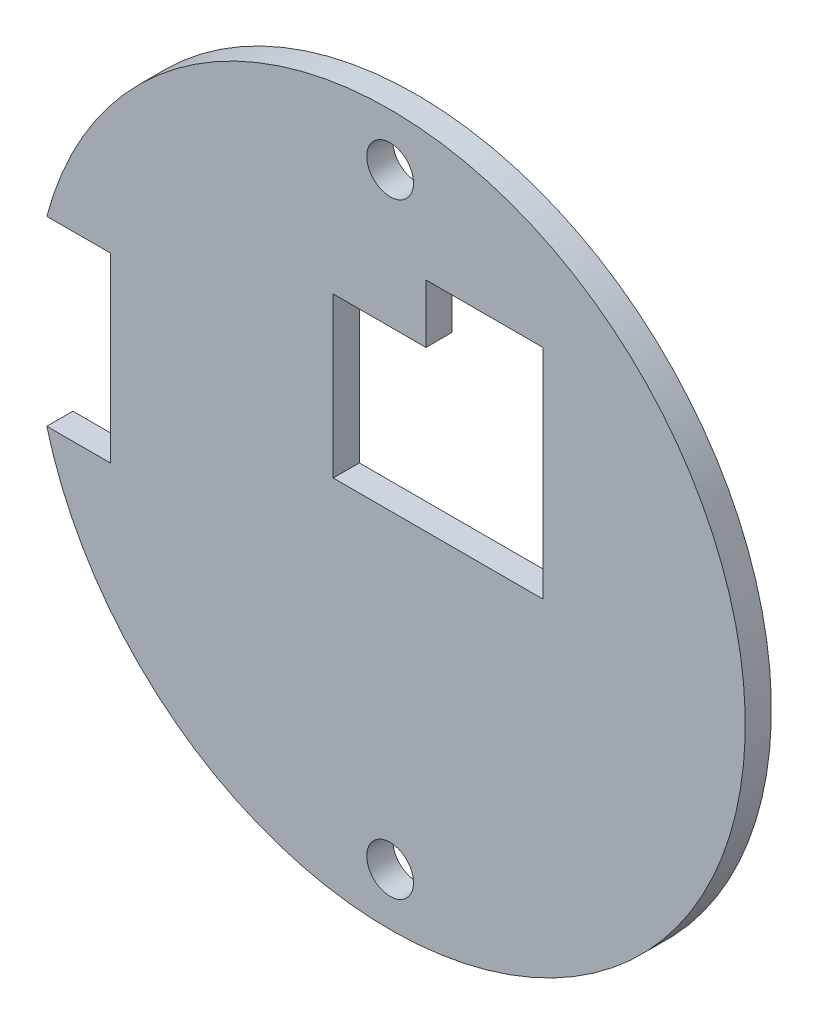
from build123d import *

# Parameters (mm, degrees)
SKETCH1_R           = 1.4224
BOSS_EXTRUDE1_DEPTH = 1.5875


with BuildPart() as part:
    # Sketch1 → Boss-Extrude1 (new body)
    with BuildSketch(Plane.XY):
        with BuildLine():
            Line((-16.984058744, 5.5245), (-20.871224203, 5.5245))
            ThreePointArc((-20.871224203, 5.5245), (21.59, 0), (-20.871224203, -5.5245))
            Line((-20.871224203, -5.5245), (-16.984058744, -5.5245))
            Line((-16.984058744, -5.5245), (-16.984058744, 5.5245))
        make_face()
        with Locations((0, 18.415)):
            Circle(SKETCH1_R, mode=Mode.SUBTRACT)
        with Locations((0, -18.415)):
            Circle(SKETCH1_R, mode=Mode.SUBTRACT)
        Polygon((9.29005, 13.7033), (2.17805, 13.7033), (2.17805, 10.1473), (-3.46075, 10.1473), (-3.46075, 0.4572), (9.29005, 0.4572), align=None, mode=Mode.SUBTRACT)
    extrude(amount=BOSS_EXTRUDE1_DEPTH)


solid = part.part
